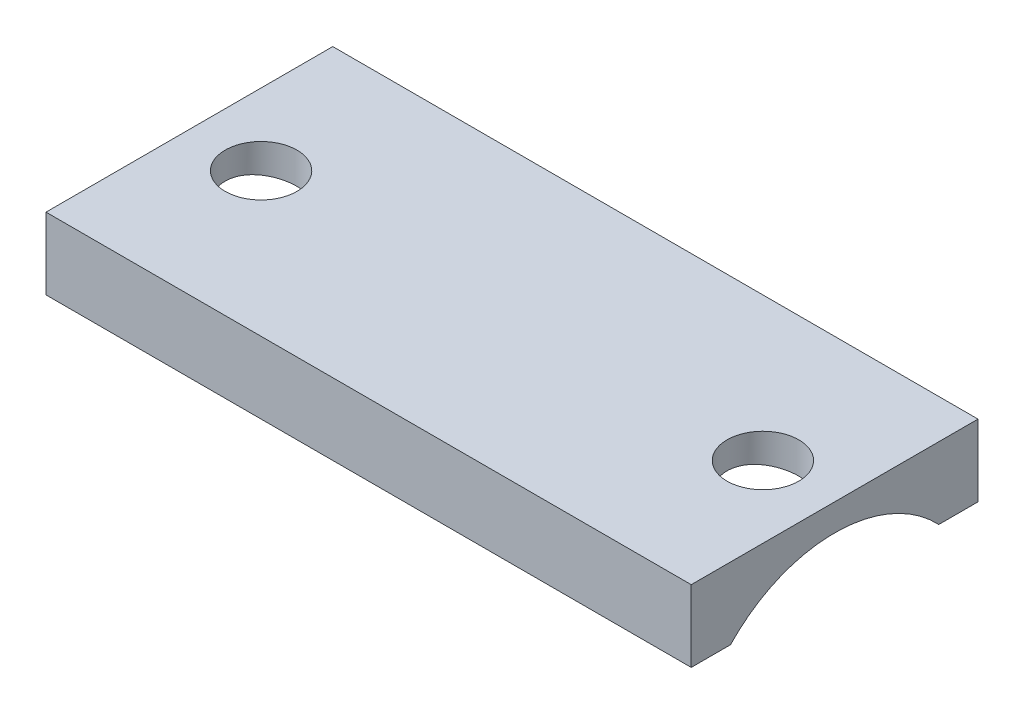
from build123d import *

# Parameters (mm, degrees)
SKETCH1_W           = 57.15
SKETCH1_H           = 25.4
BOSS_EXTRUDE1_DEPTH = 6.35
CUT_EXTRUDE1_DEPTH  = 635
SKETCH3_R           = 3.175
CUT_EXTRUDE2_DEPTH  = 6.35


with BuildPart() as part:
    # Sketch1 → Boss-Extrude1 (new body)
    with BuildSketch(Plane(origin=(0, 0, 0), x_dir=(1, 0, 0), z_dir=(0, 1, 0))):
        with Locations((28.575, 12.7)):
            Rectangle(SKETCH1_W, SKETCH1_H)
    extrude(amount=BOSS_EXTRUDE1_DEPTH)

    # Sketch2 → Cut-Extrude1 (cut)
    with BuildSketch(Plane(origin=(57.15, 0, 0), x_dir=(0, 0, -1), z_dir=(1, 0, 0))):
        with BuildLine():
            ThreePointArc((21.922541593, 0), (12.7, 3.96875), (3.477458407, 0))
            Line((3.477458407, 0), (21.922541593, 0))
        make_face()
    extrude(amount=-CUT_EXTRUDE1_DEPTH, mode=Mode.SUBTRACT)

    # Sketch3 → Cut-Extrude2 (cut)
    with BuildSketch(Plane(origin=(0, 6.35, 0), x_dir=(1, 0, 0), z_dir=(0, 1, 0))):
        with Locations((6.35, 12.7)):
            Circle(SKETCH3_R)
        with Locations((50.8, 12.7)):
            Circle(SKETCH3_R)
    extrude(amount=-CUT_EXTRUDE2_DEPTH, mode=Mode.SUBTRACT)


solid = part.part
